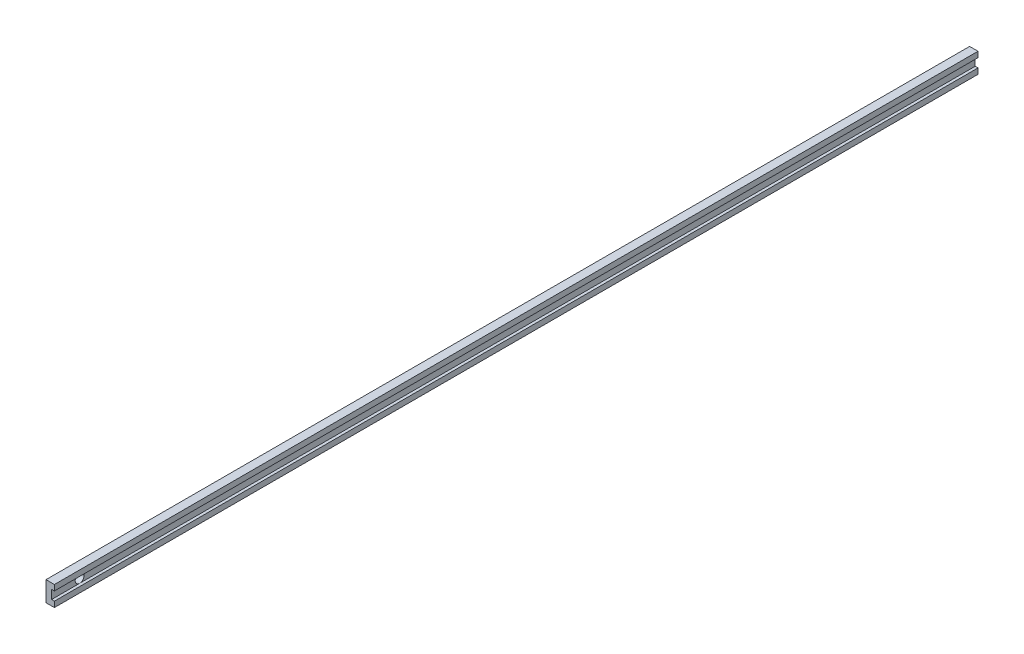
from build123d import *

# Parameters (mm, degrees)
BOSS_EXTRUDE1_DEPTH   = 838.2
F_8_0MM_DOWEL_HOLE1_D = 8


with BuildPart() as part:
    # Sketch1 → Boss-Extrude1 (new body)
    with BuildSketch(Plane.XY):
        Polygon((0, -5.318754457), (0, -13.318754457), (2.54, -13.318754457), (2.54, -18.398754457), (-5.08, -18.398754457), (-5.08, -0.238754457), (2.54, -0.238754457), (2.54, -5.318754457), align=None)
    extrude(amount=BOSS_EXTRUDE1_DEPTH)

    # Ø8.0mm Dowel Hole1 (through all)
    with Locations(Plane.ZY.offset(5.08)):
        with Locations((812.8, -9.318754457), (28.049203363, -40.337204001)):
            Hole(F_8_0MM_DOWEL_HOLE1_D / 2)


solid = part.part
